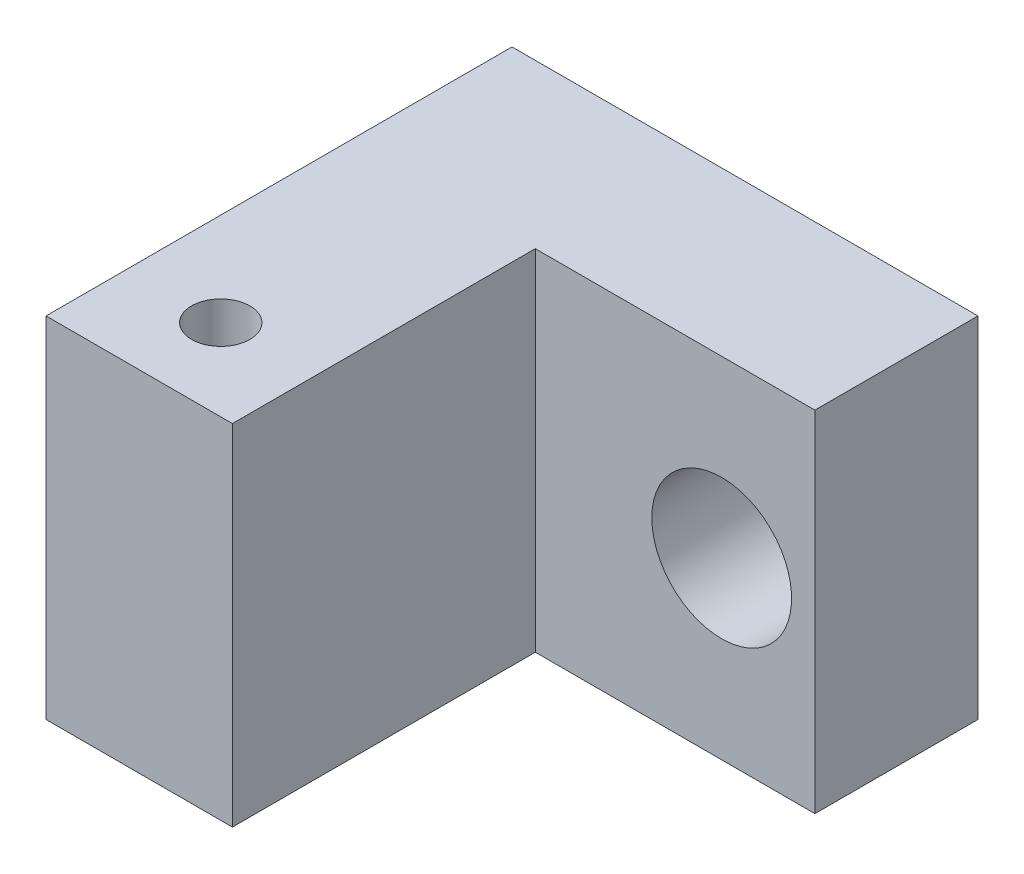
from build123d import *

# Parameters (mm, degrees)
ESTRUSIONE_ESTRUSIONE1_DEPTH = 15
SCHIZZO6_R                   = 3
TAGLIO_ESTRUSIONE1_DEPTH     = 10
FORO_FILETTATO_M3_1_D        = 2.5


with BuildPart() as part:
    # Schizzo1 → Estrusione-Estrusione1 (new body)
    with BuildSketch(Plane(origin=(0, 0, 0), x_dir=(1, 0, 0), z_dir=(0, 1, 0))):
        Polygon((8, -7), (20, -7), (20, 0), (0, 0), (0, -20), (8, -20), align=None)
    extrude(amount=ESTRUSIONE_ESTRUSIONE1_DEPTH)

    # Schizzo6 → Taglio-Estrusione1 (cut)
    with BuildSketch(Plane(origin=(0, 0, 0), x_dir=(-1, 0, 0), z_dir=(0, 0, -1))):
        with Locations((-16, 7.5)):
            Circle(SCHIZZO6_R)
    extrude(amount=-TAGLIO_ESTRUSIONE1_DEPTH, mode=Mode.SUBTRACT)

    # Foro filettato M3-1 (through all)
    with Locations(Plane(origin=(4, 15, 16.5), x_dir=(0, 0, 1), z_dir=(0, 1, 0))):
        with Locations((0, 0)):
            Hole(FORO_FILETTATO_M3_1_D / 2)


solid = part.part
